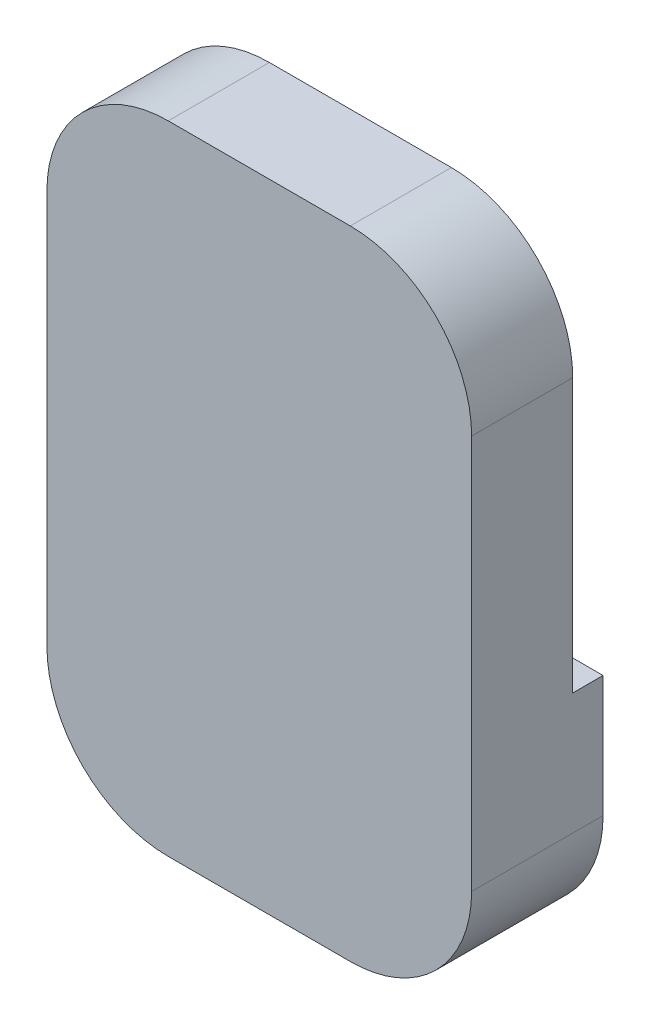
from build123d import *

# Parameters (mm, degrees)
SKETCH_2_W           = 42
SKETCH_2_H           = 63
EXTRUDE_1_DEPTH      = 10
SKETCH_3_W           = 42
SKETCH_3_H           = 24
EXTRUDE_2_DEPTH      = 10
EXTRUDE_3_DEPTH      = 32
SKETCH_5_R           = 0.74
CUT_EXTRUDE_1_DEPTH  = 10
CUT_EXTRUDE_2_DEPTH  = 7
SKETCH_8_R           = 1.6
CUT_EXTRUDE_4_DEPTH  = 3
FILLET_6_R           = 12
CUT_EXTRUDE_21_DEPTH = 7


with BuildPart() as part:
    # 草图2 → 凸台-拉伸1 (new body)
    with BuildSketch(Plane.XY):
        Rectangle(SKETCH_2_W, SKETCH_2_H)
    extrude(amount=EXTRUDE_1_DEPTH)

    # 草图3 → 凸台-拉伸2 (add)
    with BuildSketch(Plane(origin=(0, 0, 0), x_dir=(-1, 0, 0), z_dir=(0, 0, -1))):
        with Locations((0, -19.5)):
            Rectangle(SKETCH_3_W, SKETCH_3_H)
    extrude(amount=EXTRUDE_2_DEPTH)

    # 草图4 → 凸台-拉伸3 (add)
    with BuildSketch(Plane(origin=(0, -7.5, 0), x_dir=(1, 0, 0), z_dir=(0, 1, 0))):
        Polygon((3.5, 0), (5.5, 3), (-5.5, 3), (-3.5, 0), align=None)
    extrude(amount=EXTRUDE_3_DEPTH)

    # 草图5 → 切除-拉伸1 (cut)
    with BuildSketch(Plane(origin=(0, -7.5, 0), x_dir=(1, 0, 0), z_dir=(0, 1, 0))):
        with Locations((-3.81, 6.25)):
            Circle(SKETCH_5_R)
        with Locations((-1.27, 6.25)):
            Circle(SKETCH_5_R)
        with Locations((3.81, 6.25)):
            Circle(SKETCH_5_R)
        with Locations((1.27, 6.25)):
            Circle(SKETCH_5_R)
    extrude(amount=-CUT_EXTRUDE_1_DEPTH, mode=Mode.SUBTRACT)

    # 草图6 → 切除-拉伸2 (cut)
    with BuildSketch(Plane(origin=(0, 0, -10), x_dir=(-1, 0, 0), z_dir=(0, 0, -1))):
        with BuildLine():
            Line((-9.55, -19.5), (-9.55, -7.5))
            Line((-9.55, -7.5), (-21, -7.5))
            Line((-21, -7.5), (-21, -17.5))
            Line((-21, -17.5), (-19, -17.5))
            Line((-19, -17.5), (-19, -21.5))
            ThreePointArc((-19, -21.5), (-16.656854249, -27.156854249), (-11, -29.5))
            Line((-11, -29.5), (11, -29.5))
            ThreePointArc((11, -29.5), (16.656854249, -27.156854249), (19, -21.5))
            Line((19, -21.5), (19, -17.5))
            Line((19, -17.5), (21, -17.5))
            Line((21, -17.5), (21, -7.5))
            Line((21, -7.5), (9.55, -7.5))
            Line((9.55, -7.5), (9.55, -19.5))
            ThreePointArc((9.55, -19.5), (12.378427125, -20.671572875), (13.55, -23.5))
            ThreePointArc((13.55, -23.5), (11.55, -25.5), (9.55, -23.5))
            Line((9.55, -23.5), (-9.55, -23.5))
            ThreePointArc((-9.55, -23.5), (-11.55, -25.5), (-13.55, -23.5))
            ThreePointArc((-13.55, -23.5), (-12.378427125, -20.671572875), (-9.55, -19.5))
        make_face()
    extrude(amount=-CUT_EXTRUDE_2_DEPTH, mode=Mode.SUBTRACT)

    # 草图8 → 切除-拉伸4 (cut)
    with BuildSketch(Plane(origin=(0, 0, -3), x_dir=(-1, 0, 0), z_dir=(0, 0, -1))):
        with Locations((6, -26.5)):
            Circle(SKETCH_8_R)
        with Locations((-6, -26.5)):
            Circle(SKETCH_8_R)
    extrude(amount=-CUT_EXTRUDE_4_DEPTH, mode=Mode.SUBTRACT)

    # 圆角6
    fillet_6_edges = [part.edges().sort_by_distance(p)[0] for p in [
        (21, -31.5, 0),
        (-21, -31.5, 0),
        (-21, 31.5, 5),
        (21, 31.5, 5),
    ]]
    fillet(fillet_6_edges, radius=FILLET_6_R)

    # 草图43 → 切除-拉伸21 (cut)
    with BuildSketch(Plane(origin=(0, 0, -10), x_dir=(-1, 0, 0), z_dir=(0, 0, -1))):
        Polygon((6.55, -7.5), (7.55, -23.5), (7.55, -31.5), (21, -31.5), (21, -7.5), align=None)
        Polygon((-7.55, -31.5), (-7.55, -23.5), (-6.55, -7.5), (-21, -7.5), (-21, -31.5), align=None)
    extrude(amount=-CUT_EXTRUDE_21_DEPTH, mode=Mode.SUBTRACT)


solid = part.part
